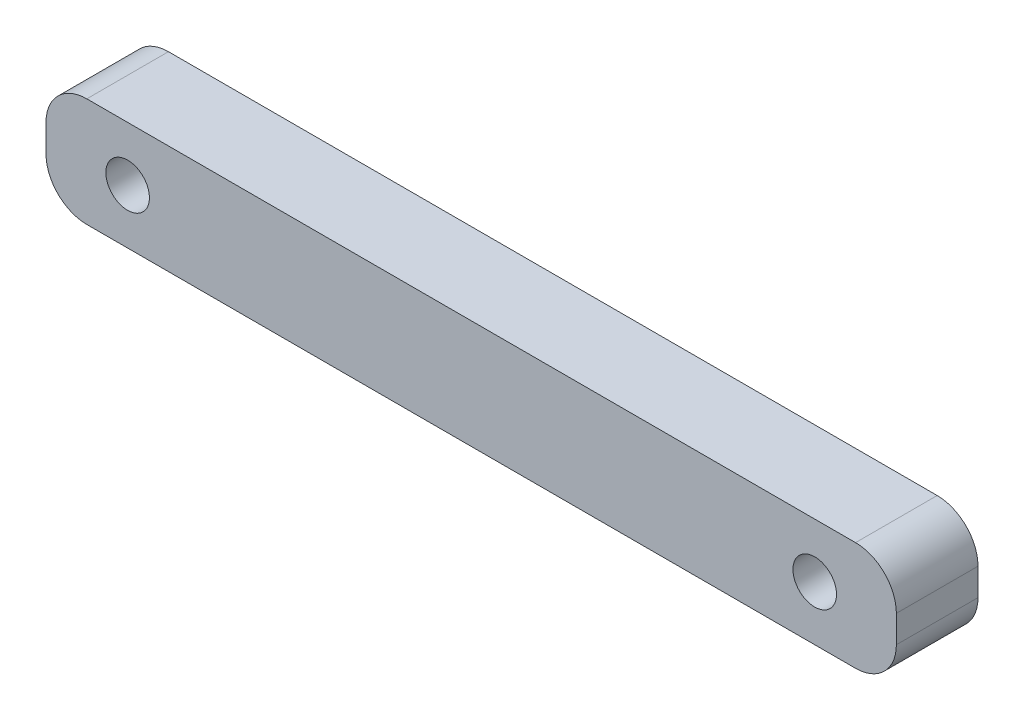
from build123d import *

# Parameters (mm, degrees)
SKETCH1_W           = 62.5
SKETCH1_H           = 8
BOSS_EXTRUDE1_DEPTH = 6
SKETCH2_R           = 1.6
CUT_EXTRUDE1_DEPTH  = 64.294944506
FILLET1_R           = 3


with BuildPart() as part:
    # Sketch1 → Boss-Extrude1 (new body)
    with BuildSketch(Plane.XY):
        with Locations((31.25, -4)):
            Rectangle(SKETCH1_W, SKETCH1_H)
    extrude(amount=BOSS_EXTRUDE1_DEPTH)

    # Sketch2 → Cut-Extrude1 (cut, through all)
    with BuildSketch(Plane.XY.offset(6)):
        with Locations((56.5, -4)):
            Circle(SKETCH2_R)
        with Locations((6, -4)):
            Circle(SKETCH2_R)
    extrude(amount=-CUT_EXTRUDE1_DEPTH, mode=Mode.SUBTRACT)

    # Fillet1
    fillet1_edges = [part.edges().sort_by_distance(p)[0] for p in [
        (0, 0, 3),
        (62.5, 0, 3),
        (62.5, -8, 3),
        (0, -8, 3),
    ]]
    fillet(fillet1_edges, radius=FILLET1_R)


solid = part.part
